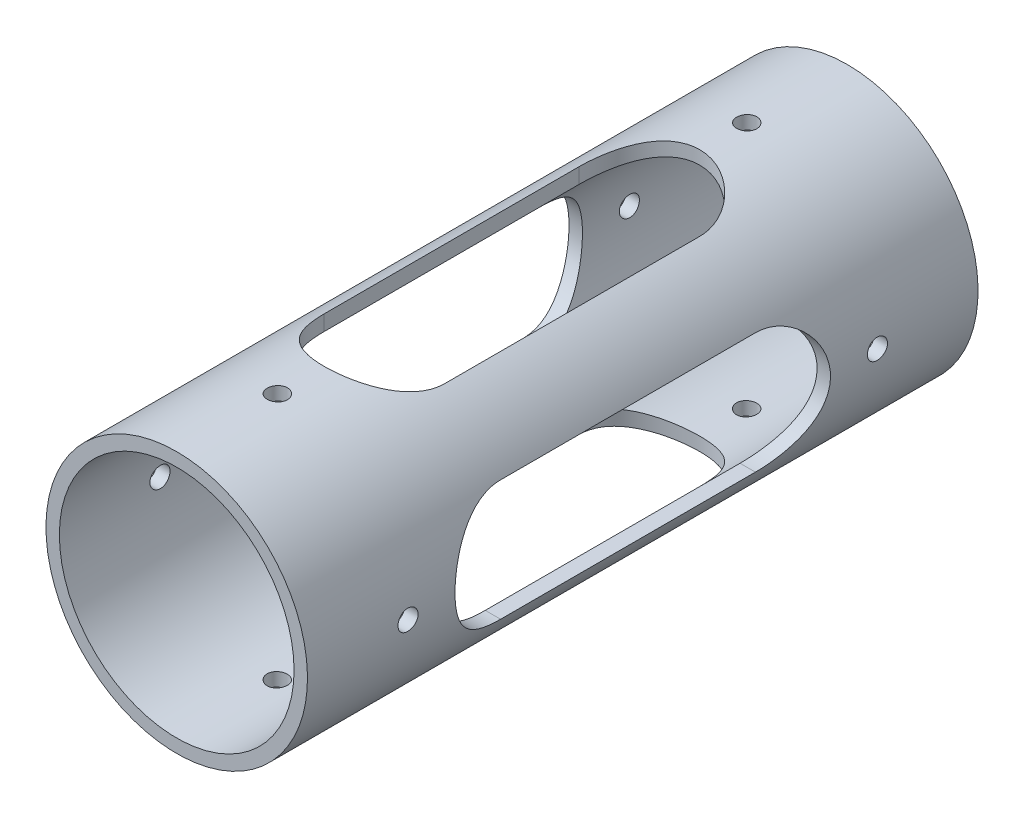
from build123d import *

# Parameters (mm, degrees)
SKETCH1_R           = 19.5
SKETCH1_R_2         = 17.5
EXTRUDE_THIN1_DEPTH = 100
SKETCH2_R           = 1.5
CUT_EXTRUDE1_DEPTH  = 104.732829905
CUT_EXTRUDE2_DEPTH  = 104.732830039
CIRPATTERN1_COUNT   = 2
CIRPATTERN1_ANGLE   = 90


with BuildPart() as part:
    # Sketch1 → Extrude-Thin1 (new body)
    with BuildSketch(Plane(origin=(0, 0, 0), x_dir=(0, 1, 0), z_dir=(0, 0, 1))):
        Circle(SKETCH1_R)
        Circle(SKETCH1_R_2, mode=Mode.SUBTRACT)
    extrude(amount=EXTRUDE_THIN1_DEPTH)

    # Sketch2 → Cut-Extrude1 (cut, symmetric)
    with BuildSketch(Plane(origin=(0, 0, 0), x_dir=(-1, 0, 0), z_dir=(0, 1, 0))):
        with Locations(Location((0, 85, 0), (0, 0, 90))):
            Circle(SKETCH2_R)
        with Locations(Location((0, 15, 0), (0, 0, 90))):
            Circle(SKETCH2_R)
    cut_extrude1 = extrude(amount=CUT_EXTRUDE1_DEPTH, both=True, mode=Mode.SUBTRACT)

    # Sketch3 → Cut-Extrude2 (cut, symmetric)
    with BuildSketch(Plane(origin=(0, 0, 0), x_dir=(-1, 0, 0), z_dir=(0, 1, 0))):
        with BuildLine():
            Line((9, 69), (9, 31))
            ThreePointArc((9, 31), (0, 22), (-9, 31))
            Line((-9, 31), (-9, 69))
            ThreePointArc((-9, 69), (0, 78), (9, 69))
        make_face()
    cut_extrude2 = extrude(amount=CUT_EXTRUDE2_DEPTH, both=True, mode=Mode.SUBTRACT)

    # CirPattern1: Cut-Extrude1, Cut-Extrude2 ×2 about axis
    cirpattern1_axis = Axis((0, 0, 100), (0, 0, -1))
    add([cut_extrude1.rotate(cirpattern1_axis, i * CIRPATTERN1_ANGLE / (CIRPATTERN1_COUNT - 1)) for i in range(1, CIRPATTERN1_COUNT)], mode=Mode.SUBTRACT)
    add([cut_extrude2.rotate(cirpattern1_axis, i * CIRPATTERN1_ANGLE / (CIRPATTERN1_COUNT - 1)) for i in range(1, CIRPATTERN1_COUNT)], mode=Mode.SUBTRACT)


solid = part.part
